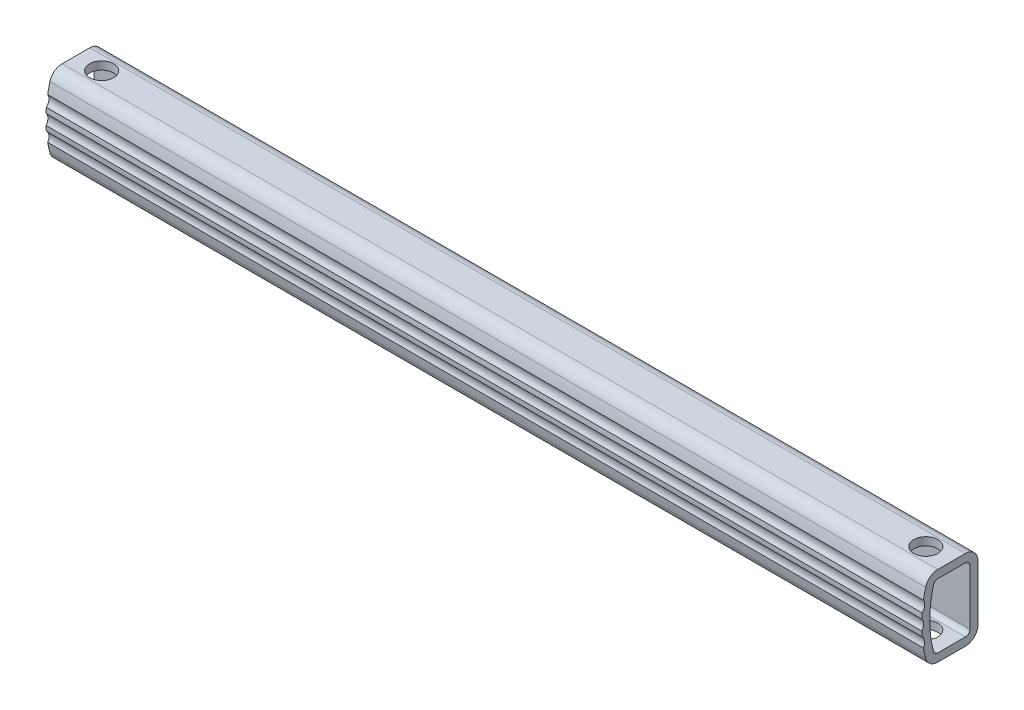
from build123d import *

# Parameters (mm, degrees)
EXTRUDE1_DEPTH          = 54.5
CUT_EXTRUDE1_DEPTH      = 55.854885702
CUT_EXTRUDE1_DEPTH_BACK = 55.854885702
SKETCH2_R               = 1.5


with BuildPart() as part:
    # Sketch1 → Extrude1 (new, symmetric)
    with BuildSketch(Plane(origin=(0, 0, 0), x_dir=(0, 0, -1), z_dir=(1, 0, 0))):
        with BuildLine():
            Line((-1.715977045, 5), (1.715977045, 5))
            ThreePointArc((1.715977045, 5), (2.824752941, 4.540729986), (3.284022955, 3.43195409))
            Line((3.284022955, 3.43195409), (3.284022955, -3.43195409))
            ThreePointArc((3.284022955, -3.43195409), (2.824752941, -4.540729986), (1.715977045, -5))
            Line((1.715977045, -5), (-1.715977045, -5))
            ThreePointArc((-1.715977045, -5), (-2.672673527, -4.674330771), (-3.23197526, -3.832600305))
            ThreePointArc((-3.23197526, -3.832600305), (-3.383560587, -3.204564402), (-3.507961213, -2.570583572))
            ThreePointArc((-3.507961213, -2.570583572), (-3.356955711, -1.900195953), (-3.674237451, -1.290643232))
            ThreePointArc((-3.674237451, -1.290643232), (-3.698584955, -0.968220458), (-3.715977045, -0.645347786))
            ThreePointArc((-3.715977045, -0.645347786), (-3.479865934, 0), (-3.715977045, 0.645347786))
            ThreePointArc((-3.715977045, 0.645347786), (-3.698584955, 0.968220458), (-3.674237451, 1.290643232))
            ThreePointArc((-3.674237451, 1.290643232), (-3.356955711, 1.900195953), (-3.507961213, 2.570583572))
            ThreePointArc((-3.507961213, 2.570583572), (-3.383560587, 3.204564402), (-3.23197526, 3.832600305))
            ThreePointArc((-3.23197526, 3.832600305), (-2.672673527, 4.674330771), (-1.715977045, 5))
        make_face()
        with BuildLine():
            Line((-1.715977045, 4), (1.715977045, 4))
            ThreePointArc((1.715977045, 4), (2.11764616, 3.833623205), (2.284022955, 3.43195409))
            Line((2.284022955, 3.43195409), (2.284022955, -3.43195409))
            ThreePointArc((2.284022955, -3.43195409), (2.11764616, -3.833623205), (1.715977045, -4))
            Line((1.715977045, -4), (-1.715977045, -4))
            ThreePointArc((-1.715977045, -4), (-2.062553328, -3.882021902), (-2.265167971, -3.577093618))
            ThreePointArc((-2.265167971, -3.577093618), (-2.729865934, 0), (-2.265167971, 3.577093618))
            ThreePointArc((-2.265167971, 3.577093618), (-2.062553328, 3.882021902), (-1.715977045, 4))
        make_face(mode=Mode.SUBTRACT)
    extrude(amount=EXTRUDE1_DEPTH, both=True)

    # Sketch2 → Cut-Extrude1 (cut, two sides: drawn at the far end of the back side and taken through both)
    with BuildSketch(Plane(origin=(0, 0, 0), x_dir=(1, 0, 0), z_dir=(0, 1, 0)).offset(-CUT_EXTRUDE1_DEPTH_BACK)):
        with Locations(Location((-51.285, 0, 0), (0, 0, 270))):
            Circle(SKETCH2_R)
        with Locations(Location((51.285, 0, 0), (0, 0, 90))):
            Circle(SKETCH2_R)
    extrude(amount=CUT_EXTRUDE1_DEPTH + CUT_EXTRUDE1_DEPTH_BACK, mode=Mode.SUBTRACT)


solid = part.part
